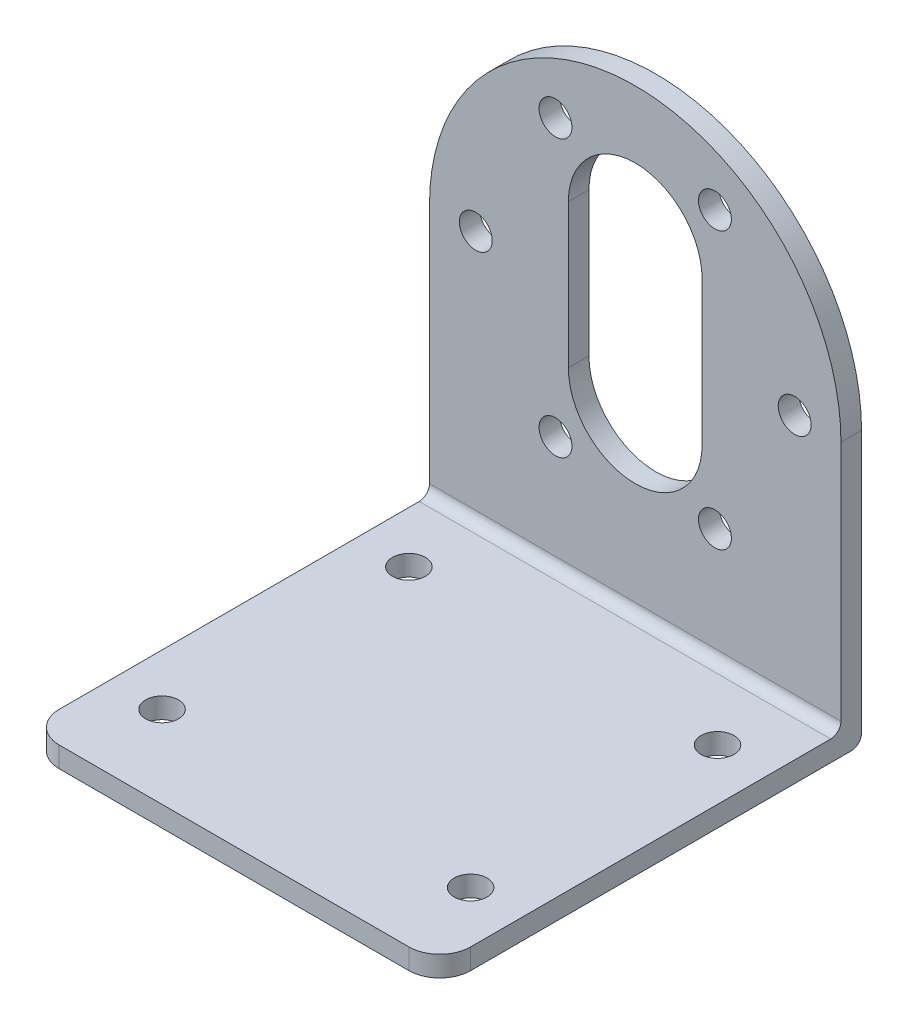
from build123d import *

# Parameters (mm, degrees)
SKETCH_1_W               = 40
SKETCH_1_H               = 41
EXTRUDE_1_DEPTH          = 2
FILLET_1_R               = 3
SKETCH_2_R               = 1.6
CUT_EXTRUDE_1_DEPTH      = 50
EXTRUDE_2_DEPTH          = 2
CUT_EXTRUDE_2_DEPTH      = 50
SKETCH_5_R               = 1.6
CUT_EXTRUDE_3_DEPTH      = 50
PATTERN_CIRCULAR_1_COUNT = 6
FILLET_2_R               = 1
FILLET_3_R               = 1


with BuildPart() as part:
    # 草图1 → 凸台-拉伸1 (new body)
    with BuildSketch(Plane(origin=(0, 0, 0), x_dir=(1, 0, 0), z_dir=(0, 1, 0))):
        Rectangle(SKETCH_1_W, SKETCH_1_H)
    extrude(amount=EXTRUDE_1_DEPTH)

    # 圆角1
    fillet_1_edges = [part.edges().sort_by_distance(p)[0] for p in [
        (20, 1, 20.5),
        (-20, 1, 20.5),
    ]]
    fillet(fillet_1_edges, radius=FILLET_1_R)

    # 草图2 → 切除-拉伸1 (cut)
    with BuildSketch(Plane(origin=(0, 2, 0), x_dir=(1, 0, 0), z_dir=(0, 1, 0))):
        with Locations(Location((-15, -12.5, 0), (0, 0, 270))):
            Circle(SKETCH_2_R)
        with Locations(Location((-15, 11.5, 0), (0, 0, 270))):
            Circle(SKETCH_2_R)
        with Locations(Location((15, 11.5, 0), (0, 0, 270))):
            Circle(SKETCH_2_R)
        with Locations(Location((15, -12.5, 0), (0, 0, 270))):
            Circle(SKETCH_2_R)
    extrude(amount=-CUT_EXTRUDE_1_DEPTH, mode=Mode.SUBTRACT)

    # 草图3 → 凸台-拉伸2 (add)
    with BuildSketch(Plane(origin=(0, 0, -20.5), x_dir=(-1, 0, 0), z_dir=(0, 0, -1))):
        with BuildLine():
            Line((-20, 0), (20, 0))
            Line((20, 0), (20, 26.5))
            ThreePointArc((20, 26.5), (0, 46.5), (-20, 26.5))
            Line((-20, 26.5), (-20, 0))
        make_face()
    extrude(amount=-EXTRUDE_2_DEPTH)

    # 草图4 → 切除-拉伸2 (cut)
    with BuildSketch(Plane(origin=(0, 0, -20.5), x_dir=(-1, 0, 0), z_dir=(0, 0, -1))):
        with BuildLine():
            Line((6.5, 33.5), (6.5, 19.5))
            ThreePointArc((6.5, 19.5), (0, 13), (-6.5, 19.5))
            Line((-6.5, 19.5), (-6.5, 33.5))
            ThreePointArc((-6.5, 33.5), (0, 40), (6.5, 33.5))
        make_face()
    extrude(amount=-CUT_EXTRUDE_2_DEPTH, mode=Mode.SUBTRACT)

    # 草图5 → 切除-拉伸3 (cut)
    with BuildSketch(Plane(origin=(0, 0, -20.5), x_dir=(-1, 0, 0), z_dir=(0, 0, -1))):
        with Locations((15.5, 26.5)):
            Circle(SKETCH_5_R)
    cut_extrude_3 = extrude(amount=-CUT_EXTRUDE_3_DEPTH, mode=Mode.SUBTRACT)

    # 阵列(圆周)1: 切除-拉伸3 ×6 about axis
    pattern_circular_1_axis = Axis((0, 26.5, 0), (0, 0, 1))
    for i in range(1, PATTERN_CIRCULAR_1_COUNT):
        add(cut_extrude_3.rotate(pattern_circular_1_axis, i * 360 / PATTERN_CIRCULAR_1_COUNT), mode=Mode.SUBTRACT)

    # 圆角2
    fillet_2_edges = [part.edges().sort_by_distance(p)[0] for p in [
        (0, 0, -20.5),
    ]]
    fillet(fillet_2_edges, radius=FILLET_2_R)

    # 圆角3
    fillet_3_edges = [part.edges().sort_by_distance(p)[0] for p in [
        (0, 2, -18.5),
    ]]
    fillet(fillet_3_edges, radius=FILLET_3_R)


solid = part.part
